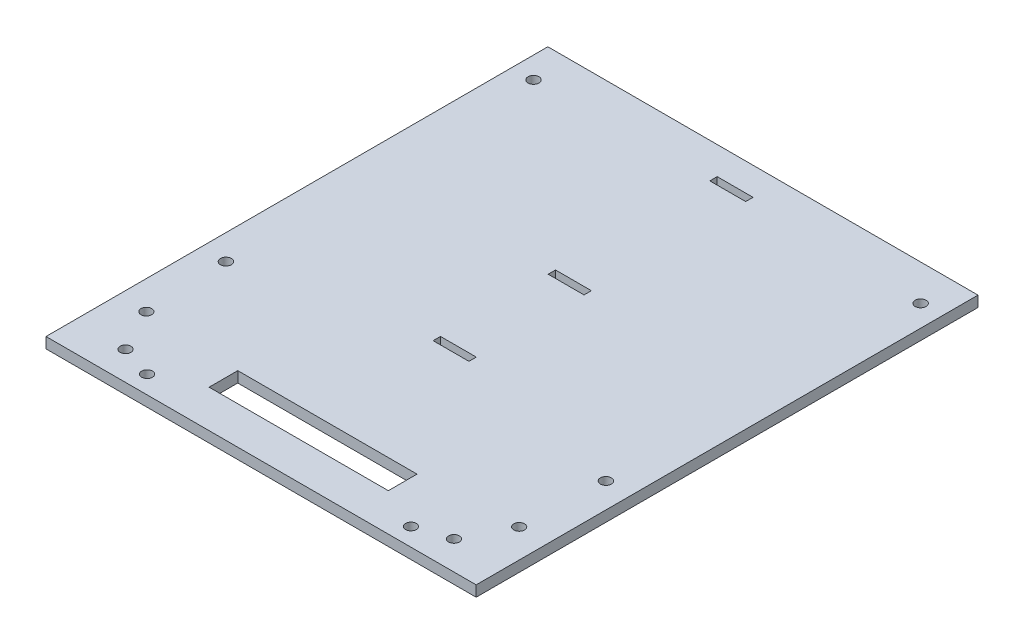
from build123d import *

# Parameters (mm, degrees)
SKETCH1_W           = 120
SKETCH1_H           = 140
BOSS_EXTRUDE1_DEPTH = 3
SKETCH2_R           = 1.525
CUT_EXTRUDE1_DEPTH  = 93.244241013
SKETCH3_W           = 10
SKETCH3_H           = 2.05
CUT_EXTRUDE2_DEPTH  = 93.244241013
SKETCH4_R           = 1.5
CUT_EXTRUDE3_DEPTH  = 3
SKETCH5_R           = 1.5
SKETCH5_W           = 50
SKETCH5_H           = 8
CUT_EXTRUDE4_DEPTH  = 3


with BuildPart() as part:
    # Sketch1 → Boss-Extrude1 (new body)
    with BuildSketch(Plane(origin=(0, 0, 0), x_dir=(1, 0, 0), z_dir=(0, 1, 0))):
        Rectangle(SKETCH1_W, SKETCH1_H)
    extrude(amount=BOSS_EXTRUDE1_DEPTH)

    # Sketch2 → Cut-Extrude1 (cut, through all)
    with BuildSketch(Plane(origin=(0, 3, 0), x_dir=(1, 0, 0), z_dir=(0, 1, 0))):
        with Locations(Location((-53, -26.81, 0), (0, 0, 270))):
            Circle(SKETCH2_R)
        with Locations(Location((-54, 60, 0), (0, 0, 270))):
            Circle(SKETCH2_R)
        with Locations(Location((53, -26.81, 0), (0, 0, 90))):
            Circle(SKETCH2_R)
        with Locations(Location((54, 60, 0), (0, 0, 90))):
            Circle(SKETCH2_R)
    extrude(amount=-CUT_EXTRUDE1_DEPTH, mode=Mode.SUBTRACT)

    # Sketch3 → Cut-Extrude2 (cut, through all)
    with BuildSketch(Plane(origin=(0, 3, 0), x_dir=(1, 0, 0), z_dir=(0, 1, 0))):
        with Locations((0, 16.115)):
            Rectangle(SKETCH3_W, SKETCH3_H)
        with Locations((0, -15.985)):
            Rectangle(SKETCH3_W, SKETCH3_H)
        with Locations((0, 61.215)):
            Rectangle(SKETCH3_W, SKETCH3_H)
    extrude(amount=-CUT_EXTRUDE2_DEPTH, mode=Mode.SUBTRACT)

    # Sketch4 → Cut-Extrude3 (cut)
    with BuildSketch(Plane(origin=(0, 3, 0), x_dir=(1, 0, 0), z_dir=(0, 1, 0))):
        with Locations(Location((-52, -50, 0), (0, 0, 270))):
            Circle(SKETCH4_R)
        with Locations(Location((-45.815341562, -62, 0), (0, 0, 270))):
            Circle(SKETCH4_R)
        with Locations(Location((45.815341562, -62, 0), (0, 0, 90))):
            Circle(SKETCH4_R)
        with Locations(Location((52, -50, 0), (0, 0, 90))):
            Circle(SKETCH4_R)
    extrude(amount=-CUT_EXTRUDE3_DEPTH, mode=Mode.SUBTRACT)

    # Sketch5 → Cut-Extrude4 (cut)
    with BuildSketch(Plane(origin=(0, 3, 0), x_dir=(1, 0, 0), z_dir=(0, 1, 0))):
        with Locations(Location((-36.8, -65, 0), (0, 0, 270))):
            Circle(SKETCH5_R)
        with Locations(Location((36.8, -65, 0), (0, 0, 90))):
            Circle(SKETCH5_R)
        with Locations((0, -55.5)):
            Rectangle(SKETCH5_W, SKETCH5_H)
    extrude(amount=-CUT_EXTRUDE4_DEPTH, mode=Mode.SUBTRACT)


solid = part.part
